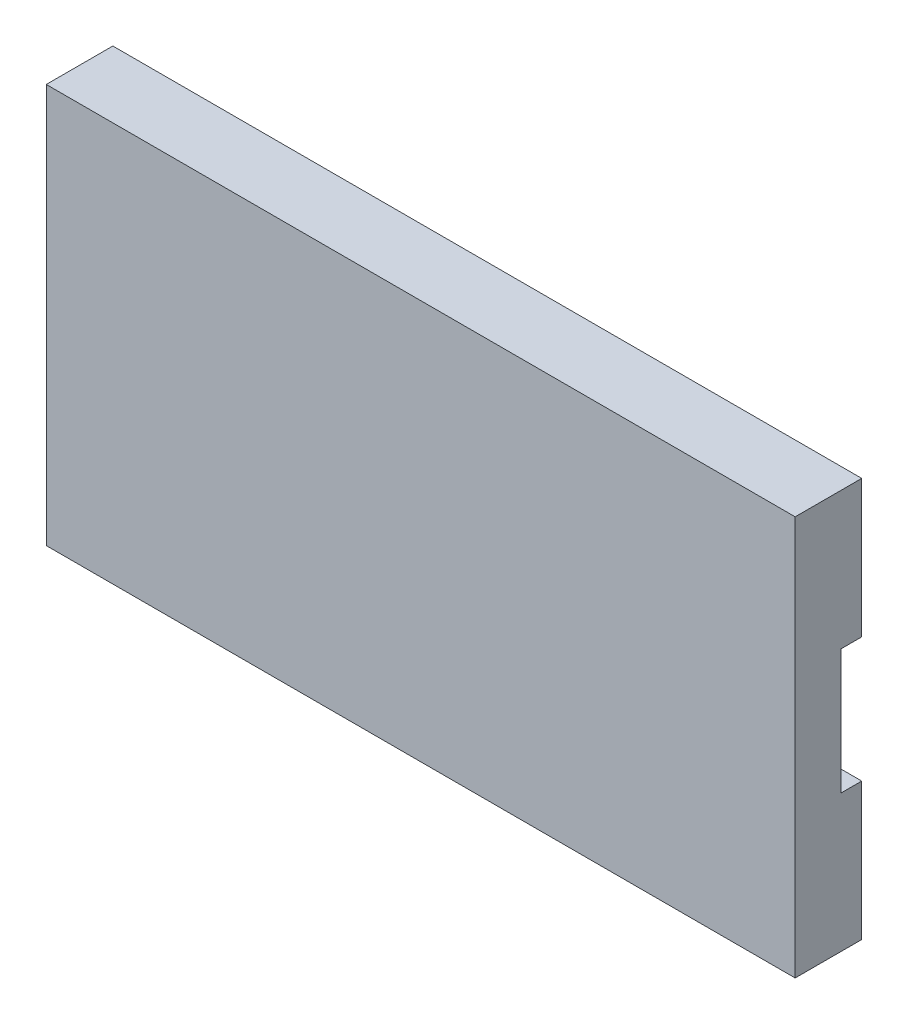
from build123d import *

# Parameters (mm, degrees)
SKETCH_1_W               = 90
SKETCH_1_H               = 48
EXTRUDE_1_DEPTH          = 8
SKETCH_4_R               = 15
CUT_EXTRUDE_3_DEPTH      = 3
SKETCH_5_R               = 1.8
CUT_EXTRUDE_4_DEPTH      = 3
MIRROR_2_COPY_1_SKETCH_R = 1.8
MIRROR_2_COPY_1_DEPTH    = 3
SKETCH_6_W               = 16
SKETCH_6_H               = 15
CUT_EXTRUDE_5_DEPTH      = 2.5


with BuildPart() as part:
    # 草图1 → 凸台-拉伸1 (new body)
    with BuildSketch(Plane.XY):
        Rectangle(SKETCH_1_W, SKETCH_1_H)
    extrude(amount=EXTRUDE_1_DEPTH)

    # 草图4 → 切除-拉伸3 (cut)
    with BuildSketch(Plane(origin=(0, 0, 0), x_dir=(-1, 0, 0), z_dir=(0, 0, -1))):
        Circle(SKETCH_4_R)
    extrude(amount=-CUT_EXTRUDE_3_DEPTH, mode=Mode.SUBTRACT)

    # 草图5 → 切除-拉伸4 (cut)
    with BuildSketch(Plane(origin=(0, 0, 0), x_dir=(-1, 0, 0), z_dir=(0, 0, -1))):
        with Locations((-41, 21)):
            Circle(SKETCH_5_R)
    cut_extrude_4 = extrude(amount=-CUT_EXTRUDE_4_DEPTH, mode=Mode.SUBTRACT)

    # 镜向1: 切除-拉伸4 across plane
    add(cut_extrude_4.mirror(Plane.ZX), mode=Mode.SUBTRACT)

    # 镜向2: 切除-拉伸4 across plane
    add(cut_extrude_4.mirror(Plane(origin=(0, 0, 0), x_dir=(0, 0, 1), z_dir=(1, 0, 0))), mode=Mode.SUBTRACT)

    # 镜向2 copy 1 sketch → 镜向2 copy 1 (cut)
    with BuildSketch(Plane(origin=(0, 0, 0), x_dir=(1, 0, 0), z_dir=(0, 0, -1))):
        with Locations((-41, 21)):
            Circle(MIRROR_2_COPY_1_SKETCH_R)
    extrude(amount=-MIRROR_2_COPY_1_DEPTH, mode=Mode.SUBTRACT)

    # 草图6 → 切除-拉伸5 (cut)
    with BuildSketch(Plane(origin=(0, 0, 0), x_dir=(-1, 0, 0), z_dir=(0, 0, -1))):
        with Locations((45, 0)):
            Rectangle(SKETCH_6_W, SKETCH_6_H)
    cut_extrude_5 = extrude(amount=-CUT_EXTRUDE_5_DEPTH, mode=Mode.SUBTRACT)

    # 镜向3: 切除-拉伸5 across plane
    add(cut_extrude_5.mirror(Plane(origin=(0, 0, 0), x_dir=(0, 0, 1), z_dir=(1, 0, 0))), mode=Mode.SUBTRACT)


solid = part.part
